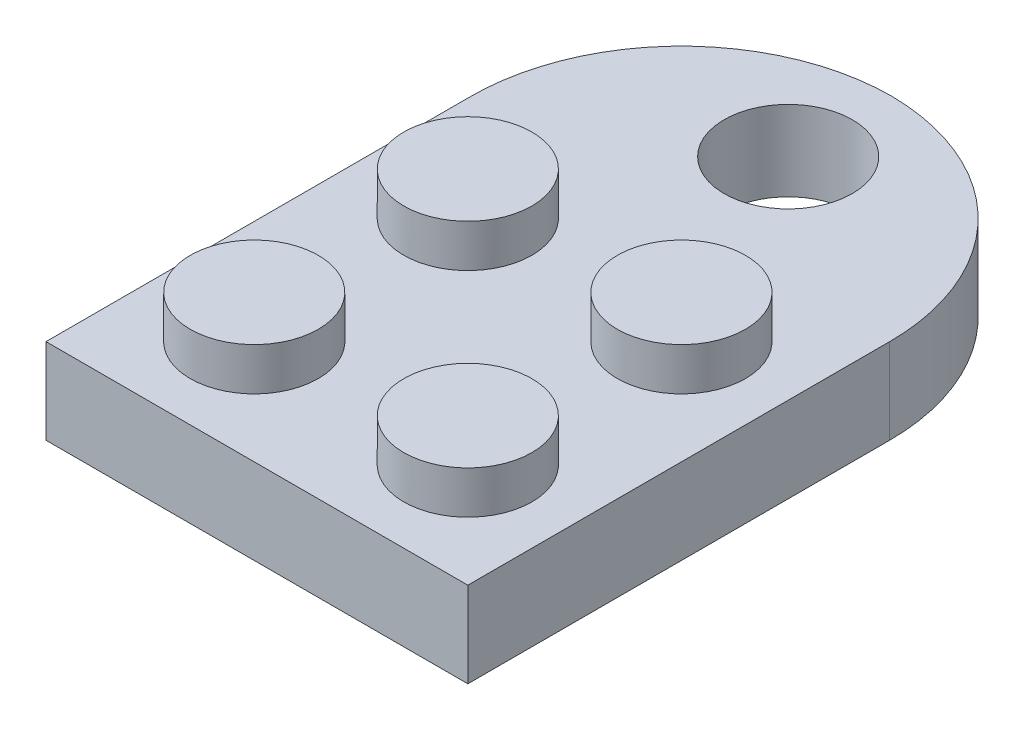
from build123d import *

# Parameters (mm, degrees)
MAINBASESKETCH_W          = 15.8
MAINBASESKETCH_H          = 3.2
MAINBASEEXTRUDE_DEPTH     = 7.9
STUDSSKETCH_R             = 2.4
STUDSEXTRUDE_DEPTH        = 1.6
STUDSPATTERN_COUNT        = 2
STUDSPATTERN_PITCH        = 8
STUDSPATTERN_COUNT_DIR2   = 2
STUDSPATTERN_PITCH_DIR2   = 8
MAINBASESHELL_T           = -1.2
UNDERSIDECIRCLEEXT_START  = -0.2
UNDERSIDECIRCLESKETCH_R   = 3.15
UNDERSIDECIRCLESKETCH_R_2 = 2.4
UNDERSIDECIRCLEEXT_DEPTH  = 1.6
SKETCH66_R                = 2.4
CUT_EXTRUDE19_DEPTH       = 24.398829954
CUT_EXTRUDE20_DEPTH       = 2.4
BOSS_EXTRUDE1_START       = -0.2
SKETCH66_6_R              = 3.25
SKETCH66_6_R_2            = 2.4
BOSS_EXTRUDE1_DEPTH       = 2.2


with BuildPart() as part:
    # MainBaseSketch → MainBaseExtrude (new, symmetric)
    with BuildSketch(Plane.XY):
        with Locations((8.581967213, 1.6)):
            Rectangle(MAINBASESKETCH_W, MAINBASESKETCH_H)
    extrude(amount=MAINBASEEXTRUDE_DEPTH, both=True)

    # StudsSketch → StudsExtrude (add)
    with BuildSketch(Plane(origin=(0, 3.2, 0), x_dir=(1, 0, 0), z_dir=(0, 1, 0))):
        with Locations((4.581967213, 4)):
            Circle(STUDSSKETCH_R)
    studsextrude = extrude(amount=STUDSEXTRUDE_DEPTH)

    # StudsPattern: StudsExtrude 2 × 2
    with Locations(*[(j * STUDSPATTERN_PITCH_DIR2, 0, i * STUDSPATTERN_PITCH) for i in range(STUDSPATTERN_COUNT) for j in range(STUDSPATTERN_COUNT_DIR2) if (i, j) != (0, 0)]):
        add(studsextrude)

    # MainBaseShell
    mainbaseshell_openings = [part.faces().sort_by_distance(p)[0] for p in [
        (8.581967213, 0, 0),
    ]]
    offset(amount=MAINBASESHELL_T, openings=mainbaseshell_openings, kind=Kind.INTERSECTION)

    # UnderSideCircleSketch → UnderSideCircleExt (add)
    with BuildSketch(Plane.XZ.offset(-2).offset(UNDERSIDECIRCLEEXT_START)):
        with Locations((8.581967213, 0)):
            Circle(UNDERSIDECIRCLESKETCH_R)
        with Locations((8.581967213, 0)):
            Circle(UNDERSIDECIRCLESKETCH_R_2, mode=Mode.SUBTRACT)
    extrude(amount=UNDERSIDECIRCLEEXT_DEPTH)

    # Sweep6: sweep along a curve in space
    with BuildLine() as sweep6_path:
        Line((16.481967213, 0, -7.9), (16.481967213, 3.2, -7.9))
    # Sketch64 → Sweep6 (sweep)
    with BuildSketch(Plane(origin=(0, 3.2, 0), x_dir=(1, 0, 0), z_dir=(0, 1, 0))):
        with BuildLine():
            Line((0.681967213, 7.9), (16.481967213, 7.9))
            ThreePointArc((16.481967213, 7.9), (14.174104013, 13.52161009), (8.581967213, 15.9))
            ThreePointArc((8.581967213, 15.9), (2.960357123, 13.550714964), (0.681967213, 7.9))
        make_face()
    sweep(path=sweep6_path.line)

    # Sketch66 → Cut-Extrude19 (cut, through all)
    with BuildSketch(Plane(origin=(0, 0, 0), x_dir=(-1, 0, 0), z_dir=(0, -1, 0))):
        with Locations((-8.581967213, 12)):
            Circle(SKETCH66_R)
    extrude(amount=-CUT_EXTRUDE19_DEPTH, mode=Mode.SUBTRACT)

    # Sketch68 → Cut-Extrude20 (cut)
    with BuildSketch(Plane(origin=(0, 0, 0), x_dir=(-1, 0, 0), z_dir=(0, -1, 0))):
        with BuildLine():
            Line((-15.281967213, 7.9), (-1.881967213, 7.9))
            ThreePointArc((-1.881967213, 7.9), (-3.808255779, 12.873274015), (-8.581967213, 15.251450042))
            ThreePointArc((-8.581967213, 15.251450042), (-13.355678647, 12.873274015), (-15.281967213, 7.9))
        make_face()
    extrude(amount=-CUT_EXTRUDE20_DEPTH, mode=Mode.SUBTRACT)

    # Sketch66<6> → Boss-Extrude1 (add)
    with BuildSketch(Plane(origin=(0, 0, 0), x_dir=(-1, 0, 0), z_dir=(0, -1, 0)).offset(BOSS_EXTRUDE1_START)):
        with Locations((-8.581967213, 12)):
            Circle(SKETCH66_6_R)
        with Locations((-8.581967213, 12)):
            Circle(SKETCH66_6_R_2, mode=Mode.SUBTRACT)
    extrude(amount=-BOSS_EXTRUDE1_DEPTH)


solid = part.part
